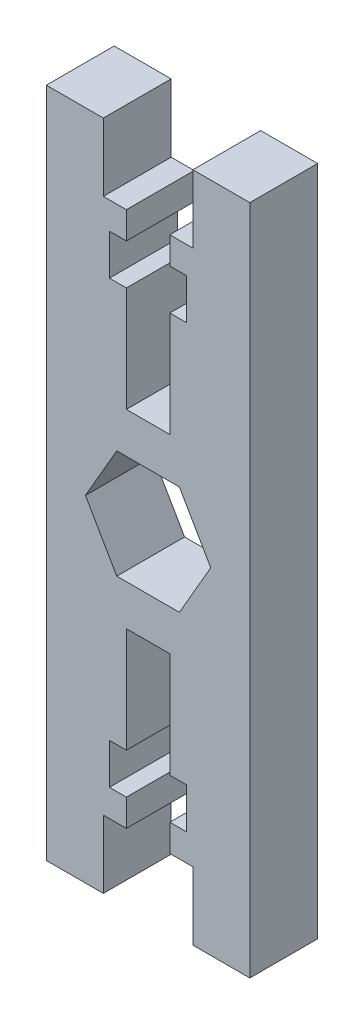
from build123d import *

# Parameters (mm, degrees)
BOSS_EXTRU_1_DEPTH      = 5
ESQUISSE2_W             = 11.095305832
ESQUISSE2_H             = 52.844950213
ESQUISSE2_W_2           = 7.610241821
ESQUISSE2_H_2           = 54.125177809
ENL_V_MAT_EXTRU_1_DEPTH = 10
ENL_V_MAT_EXTRU_2_DEPTH = 10


with BuildPart() as part:
    # Esquisse1 → Boss.-Extru.1 (new body)
    with BuildSketch(Plane.XY):
        Polygon((-12.911051911, 41.325067336), (-12.911051911, -8.174932664), (-6.211051911, -8.174932664), (-6.211051911, -3.174932664), (-4.511051911, -3.174932664), (-4.511051911, -1.178236629), (-5.761051911, -1.178236629), (-5.761051911, 1.821763371), (-4.511051911, 1.821763371), (-4.511051911, 9.575067336), (-1.311051911, 9.575067336), (-1.311051911, 1.821763371), (-0.061051911, 1.821763371), (-0.061051911, -1.178236629), (-1.311051911, -1.178236629), (-1.311051911, -3.174932664), (0.388948089, -3.174932664), (0.388948089, -8.174932664), (7.088948089, -8.174932664), (7.088948089, 41.325067336), (0.388948089, 41.325067336), (0.388948089, 36.325067336), (-1.311051911, 36.325067336), (-1.311051911, 34.328371301), (-0.061051911, 34.328371301), (-0.061051911, 31.328371301), (-1.311051911, 31.328371301), (-1.311051911, 23.575067336), (-4.511051911, 23.575067336), (-4.511051911, 31.328371301), (-5.761051911, 31.328371301), (-5.761051911, 34.328371301), (-4.511051911, 34.328371301), (-4.511051911, 36.325067336), (-6.211051911, 36.325067336), (-6.211051911, 41.325067336), align=None)
    extrude(amount=BOSS_EXTRU_1_DEPTH)

    # Esquisse2 → Enlèv. mat.-Extru.1 (cut)
    with BuildSketch(Plane(origin=(0, 0, 0), x_dir=(-1, 0, 0), z_dir=(0, 0, -1))):
        with Locations((-10.136601005, 16.610629213)):
            Rectangle(ESQUISSE2_W, ESQUISSE2_H)
        with Locations((14.216172822, 16.610629214)):
            Rectangle(ESQUISSE2_W_2, ESQUISSE2_H_2)
    extrude(amount=-ENL_V_MAT_EXTRU_1_DEPTH, mode=Mode.SUBTRACT)

    # Esquisse3 → Enlèv. mat.-Extru.2 (cut)
    with BuildSketch(Plane(origin=(0, 0, 0), x_dir=(-1, 0, 0), z_dir=(0, 0, -1))):
        Polygon((5.220452988, 12.575067336), (7.529854064, 16.575067336), (5.220452988, 20.575067336), (0.601650834, 20.575067336), (-1.707750243, 16.575067336), (0.601650834, 12.575067336), align=None)
    extrude(amount=-ENL_V_MAT_EXTRU_2_DEPTH, mode=Mode.SUBTRACT)


solid = part.part
